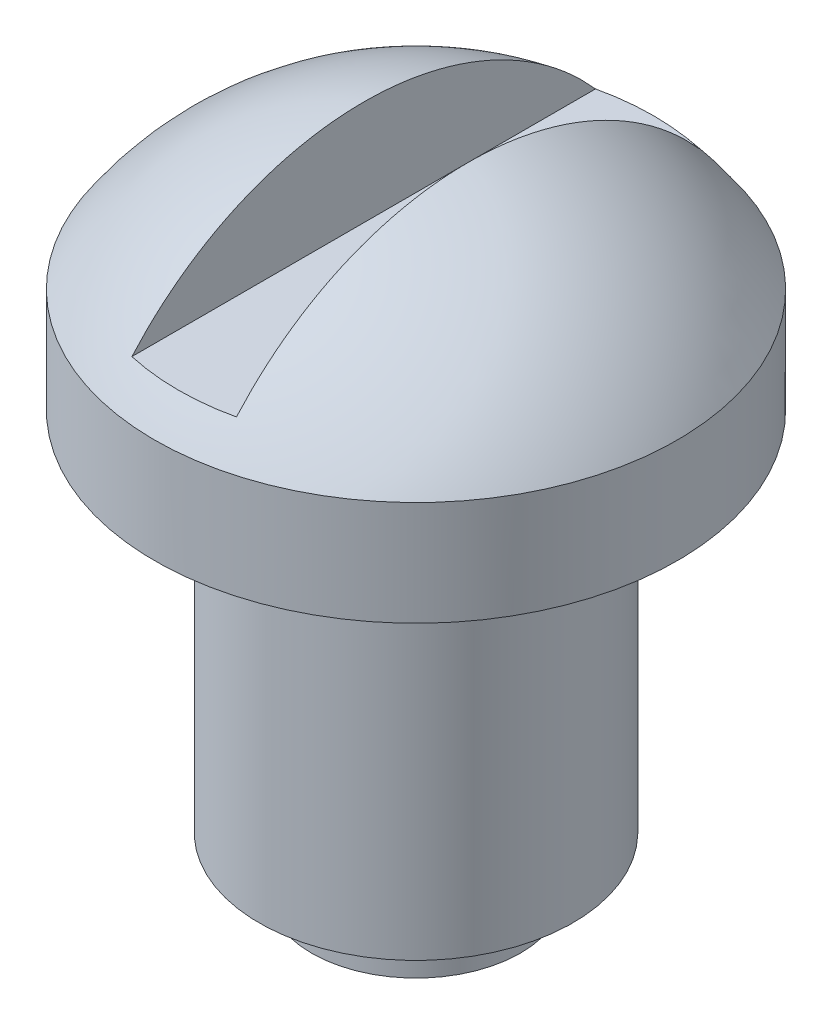
from build123d import *

# Parameters (mm, degrees)
SKETCH1_W               = 2
SKETCH1_H               = 1
CUT_EXTRUDE1_DEPTH      = 15.521294939
CUT_EXTRUDE1_DEPTH_BACK = 15.521294939


with BuildPart() as part:
    # Sketch1 → Revolve1 (revolve)
    with BuildSketch(Plane.XY, mode=Mode.PRIVATE) as revolve1_sk:
        with BuildLine():
            Line((0, 10), (5, 10))
            ThreePointArc((5, 10), (2.837274331, 11.970139283), (0, 12.68337521))
            Line((0, 12.68337521), (0, 10))
        make_face()
        Polygon((5, 10), (0, 10), (0, 8), (3, 8), (5, 8), align=None)
        Polygon((3, 8), (0, 8), (0, 1), (2, 1), (3, 1), align=None)
        with Locations((1, 0.5)):
            Rectangle(SKETCH1_W, SKETCH1_H)
    revolve(revolve1_sk.sketch.rotate(Axis((0, 8, 0), (0, 1, 0)), 90), axis=Axis((0, 8, 0), (0, 1, 0)))

    # Sketch2 → Cut-Extrude1 (cut, two sides: drawn at the far end of the back side and taken through both)
    with BuildSketch(Plane.XY.offset(-CUT_EXTRUDE1_DEPTH_BACK)):
        with BuildLine():
            Line((1, 10.599454993), (1, 12.599454993))
            ThreePointArc((1, 12.599454993), (0.501757562, 12.662358346), (0, 12.68337521))
            Line((0, 12.68337521), (0, 10.599454993))
            Line((0, 10.599454993), (1, 10.599454993))
        make_face()
        with BuildLine():
            Line((-1, 10.599454993), (0, 10.599454993))
            Line((0, 10.599454993), (0, 12.68337521))
            ThreePointArc((0, 12.68337521), (-0.501757562, 12.662358346), (-1, 12.599454993))
            Line((-1, 12.599454993), (-1, 10.599454993))
        make_face()
    extrude(amount=CUT_EXTRUDE1_DEPTH + CUT_EXTRUDE1_DEPTH_BACK, mode=Mode.SUBTRACT)


solid = part.part
